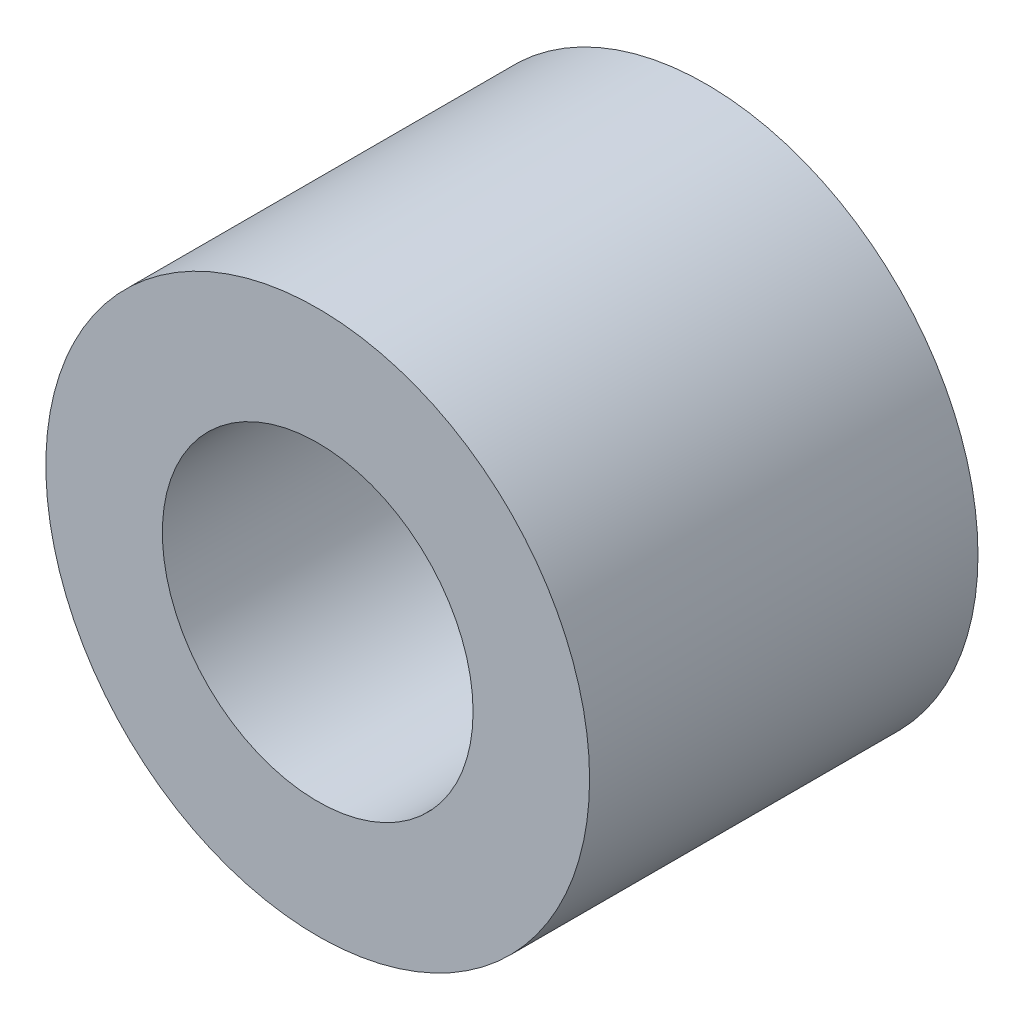
from build123d import *

# Parameters (mm, degrees)
ESQUISSE1_R        = 3.5
ESQUISSE1_R_2      = 2
BOSS_EXTRU_1_DEPTH = 5


with BuildPart() as part:
    # Esquisse1 → Boss.-Extru.1 (new body)
    with BuildSketch(Plane.XY):
        Circle(ESQUISSE1_R)
        Circle(ESQUISSE1_R_2, mode=Mode.SUBTRACT)
    extrude(amount=BOSS_EXTRU_1_DEPTH)


solid = part.part
